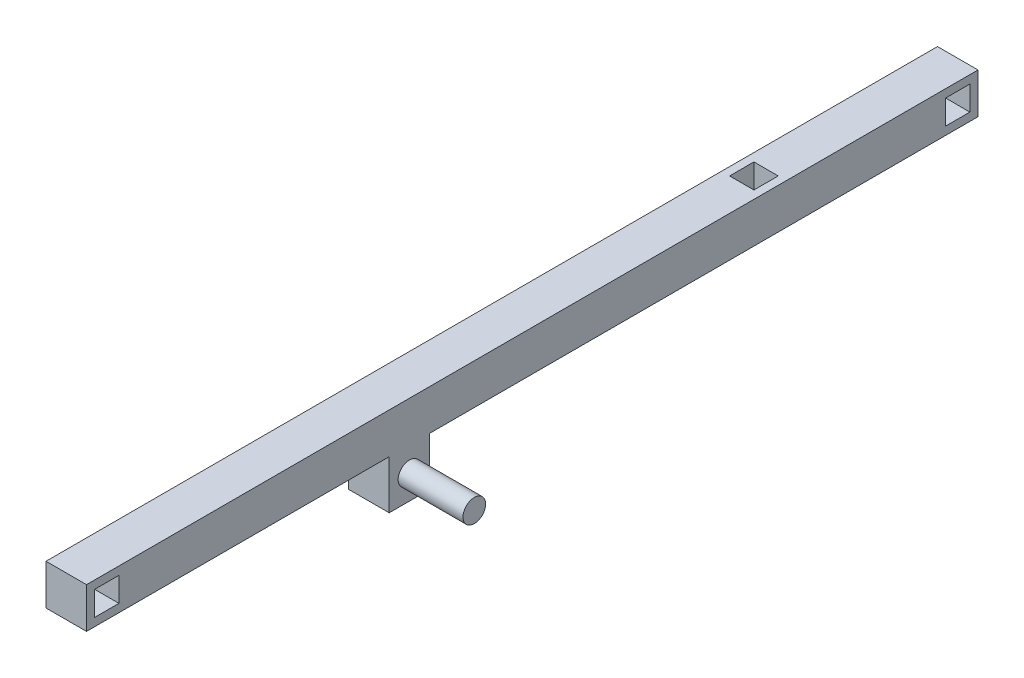
from build123d import *

# Parameters (mm, degrees)
SKETCH1_W           = 5
SKETCH1_H           = 5
BOSS_EXTRUDE1_DEPTH = 110
SKETCH2_W           = 3
SKETCH2_H           = 3
CUT_EXTRUDE1_DEPTH  = 9
SKETCH3_W           = 3
SKETCH3_H           = 3
CUT_EXTRUDE2_DEPTH  = 9
SKETCH4_W           = 5
SKETCH4_H           = 5
BOSS_EXTRUDE2_DEPTH = 6
SKETCH5_R           = 1.4
BOSS_EXTRUDE3_DEPTH = 13


with BuildPart() as part:
    # Sketch1 → Boss-Extrude1 (new body)
    with BuildSketch(Plane.XY):
        with Locations((2.5, 2.5)):
            Rectangle(SKETCH1_W, SKETCH1_H)
    extrude(amount=BOSS_EXTRUDE1_DEPTH)

    # Sketch2 → Cut-Extrude1 (cut)
    with BuildSketch(Plane.ZY):
        with Locations((2.5, 2.5)):
            Rectangle(SKETCH2_W, SKETCH2_H)
        with Locations((107.5, 2.5)):
            Rectangle(SKETCH2_W, SKETCH2_H)
    extrude(amount=-CUT_EXTRUDE1_DEPTH, mode=Mode.SUBTRACT)

    # Sketch3 → Cut-Extrude2 (cut)
    with BuildSketch(Plane(origin=(0, 5, 0), x_dir=(1, 0, 0), z_dir=(0, 1, 0))):
        with Locations((2.5, -25.15)):
            Rectangle(SKETCH3_W, SKETCH3_H)
    extrude(amount=-CUT_EXTRUDE2_DEPTH, mode=Mode.SUBTRACT)

    # Sketch4 → Boss-Extrude2 (add)
    with BuildSketch(Plane(origin=(0, 0, 0), x_dir=(-1, 0, 0), z_dir=(0, -1, 0))):
        with Locations((-2.5, -70.15)):
            Rectangle(SKETCH4_W, SKETCH4_H)
    extrude(amount=BOSS_EXTRUDE2_DEPTH)

    # Sketch5 → Boss-Extrude3 (add)
    with BuildSketch(Plane.ZY):
        with Locations((70.15, -3)):
            Circle(SKETCH5_R)
    extrude(amount=-BOSS_EXTRUDE3_DEPTH)


solid = part.part
